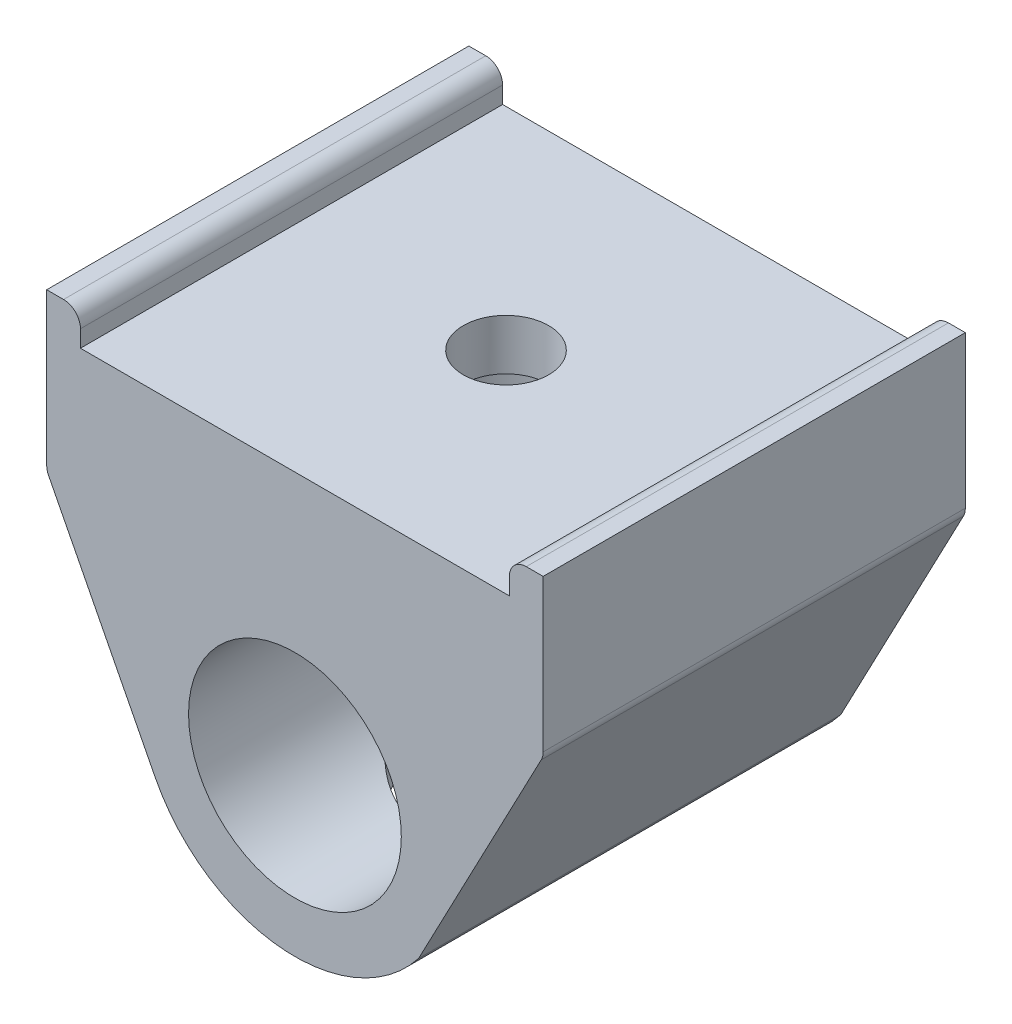
from build123d import *

# Parameters (mm, degrees)
SKETCH1_R                  = 6.3
BOSS_EXTRUDE1_DEPTH        = 25
F_8_0_199_DIAMETER_HOLE1_D = 5.0546
CUT_EXTRUDE2_START         = -3
SKETCH5_R                  = 5.08
CUT_EXTRUDE2_DEPTH         = 36.191785898
SKETCH6_W                  = 2
SKETCH6_H                  = 2
BOSS_EXTRUDE2_DEPTH        = 25
FILLET1_R                  = 1


with BuildPart() as part:
    # Sketch1 → Boss-Extrude1 (new body)
    with BuildSketch(Plane.XY):
        with BuildLine():
            Line((14.7, 8.3), (14.7, 15.55))
            Line((14.7, 15.55), (-14.7, 15.55))
            Line((-14.7, 15.55), (-14.7, 8.3))
            Line((-14.7, 8.3), (-8.277443092, -4.239567886))
            ThreePointArc((-8.277443092, -4.239567886), (-0.883815497, -9.25790852), (7.325770018, -5.729144233))
            Line((7.325770018, -5.729144233), (14.7, 8.3))
        make_face()
        Circle(SKETCH1_R, mode=Mode.SUBTRACT)
    extrude(amount=BOSS_EXTRUDE1_DEPTH)

    # #8 (0.199) Diameter Hole1 (through all)
    with Locations(Plane(origin=(0, 15.55, 0), x_dir=(1, 0, 0), z_dir=(0, 1, 0))):
        with Locations((0, -12.5)):
            Hole(F_8_0_199_DIAMETER_HOLE1_D / 2)

    # Sketch5 → Cut-Extrude2 (cut, through all)
    with BuildSketch(Plane(origin=(0, 15.55, 0), x_dir=(1, 0, 0), z_dir=(0, 1, 0)).offset(CUT_EXTRUDE2_START)):
        with Locations(Location((0, -12.5, 0), (0, 0, 180))):
            Circle(SKETCH5_R)
    extrude(amount=-CUT_EXTRUDE2_DEPTH, mode=Mode.SUBTRACT)

    # Sketch6 → Boss-Extrude2 (add)
    with BuildSketch(Plane(origin=(0, 0, 0), x_dir=(-1, 0, 0), z_dir=(0, 0, -1))):
        with Locations((13.7, 16.55)):
            Rectangle(SKETCH6_W, SKETCH6_H)
        with Locations((-13.7, 16.55)):
            Rectangle(SKETCH6_W, SKETCH6_H)
    extrude(amount=-BOSS_EXTRUDE2_DEPTH)

    # Fillet1
    fillet1_edges = [part.edges().sort_by_distance(p)[0] for p in [
        (-14.7, 8.3, 12.5),
        (14.7, 8.3, 12.5),
        (-12.7, 17.55, 12.5),
        (12.7, 17.55, 12.5),
    ]]
    fillet(fillet1_edges, radius=FILLET1_R)


solid = part.part
